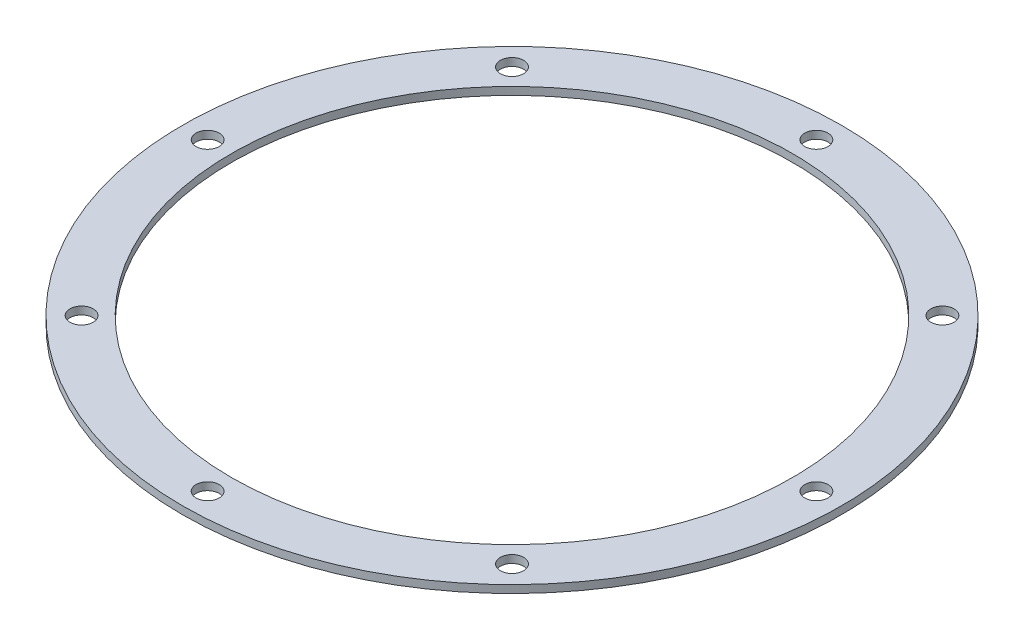
from build123d import *

# Parameters (mm, degrees)
SKETCH1_R             = 85
SKETCH1_R_2           = 78.5
SKETCH1_R_3           = 72.375
BOSS_EXTRUDE1_DEPTH   = 2
F_6_0MM_DOWEL_HOLE1_D = 6


with BuildPart() as part:
    # Sketch1 → Boss-Extrude1 (new body)
    # profile 1 of 2: a face of its own
    with BuildSketch(Plane(origin=(0, 0, 0), x_dir=(1, 0, 0), z_dir=(0, 1, 0))):
        with Locations(Location((0, 0, 0), (0, 0, 270))):
            Circle(SKETCH1_R)
        Circle(SKETCH1_R_2, mode=Mode.SUBTRACT)
    # profile 2 of 2: a face of its own
    with BuildSketch(Plane(origin=(0, 0, 0), x_dir=(1, 0, 0), z_dir=(0, 1, 0))):
        Circle(SKETCH1_R_2)
        with Locations(Location((0, 0, 0), (0, 0, 270))):
            Circle(SKETCH1_R_3, mode=Mode.SUBTRACT)
    extrude(amount=BOSS_EXTRUDE1_DEPTH)

    # Ø6.0mm Dowel Hole1 (through all)
    with Locations(Plane(origin=(0, 0, 0), x_dir=(-1, 0, 0), z_dir=(0, -1, 0))):
        with Locations((-55.507882323, 55.507882323), (0, 78.5), (55.507882323, 55.507882323), (78.5, 0), (55.507882323, -55.507882323), (0, -78.5), (-55.507882323, -55.507882323), (-78.5, 0)):
            Hole(F_6_0MM_DOWEL_HOLE1_D / 2)


solid = part.part
